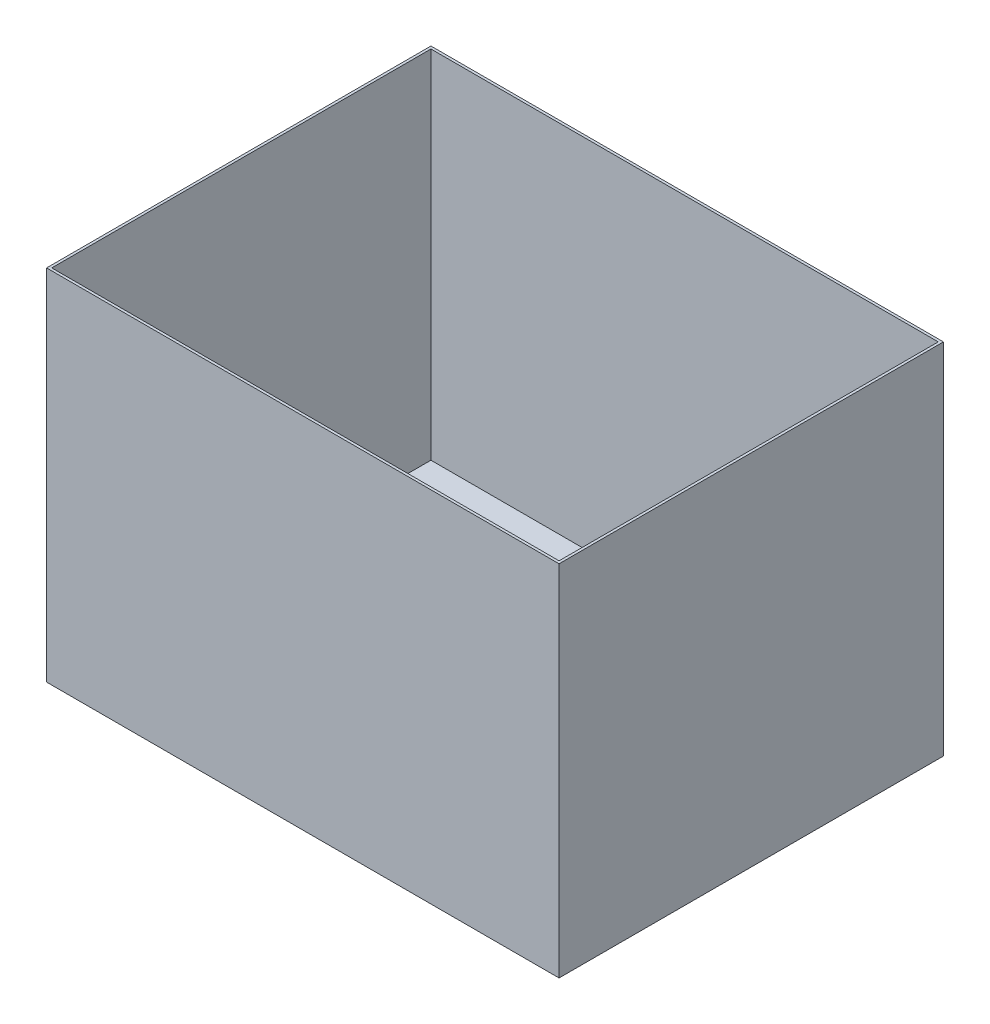
from build123d import *

# Parameters (mm, degrees)
SKETCH_1_W        = 400
SKETCH_1_H        = 300
EXTRUDE_282_DEPTH = 2
SKETCH_1_3_W      = 400
SKETCH_1_3_H      = 300
SKETCH_1_3_W_2    = 396
SKETCH_1_3_H_2    = 296
EXTRUDE_337_DEPTH = 280


with BuildPart() as part:
    # 草图1 → Extrude 282 (new body)
    with BuildSketch(Plane(origin=(0, 0, 0), x_dir=(1, 0, 0), z_dir=(0, 1, 0))):
        Rectangle(SKETCH_1_W, SKETCH_1_H)
    extrude(amount=EXTRUDE_282_DEPTH)

    # 草图1<3> → Extrude 337 (add)
    with BuildSketch(Plane(origin=(0, 0, 0), x_dir=(1, 0, 0), z_dir=(0, 1, 0))):
        Rectangle(SKETCH_1_3_W, SKETCH_1_3_H)
        Rectangle(SKETCH_1_3_W_2, SKETCH_1_3_H_2, mode=Mode.SUBTRACT)
    extrude(amount=EXTRUDE_337_DEPTH)


solid = part.part
